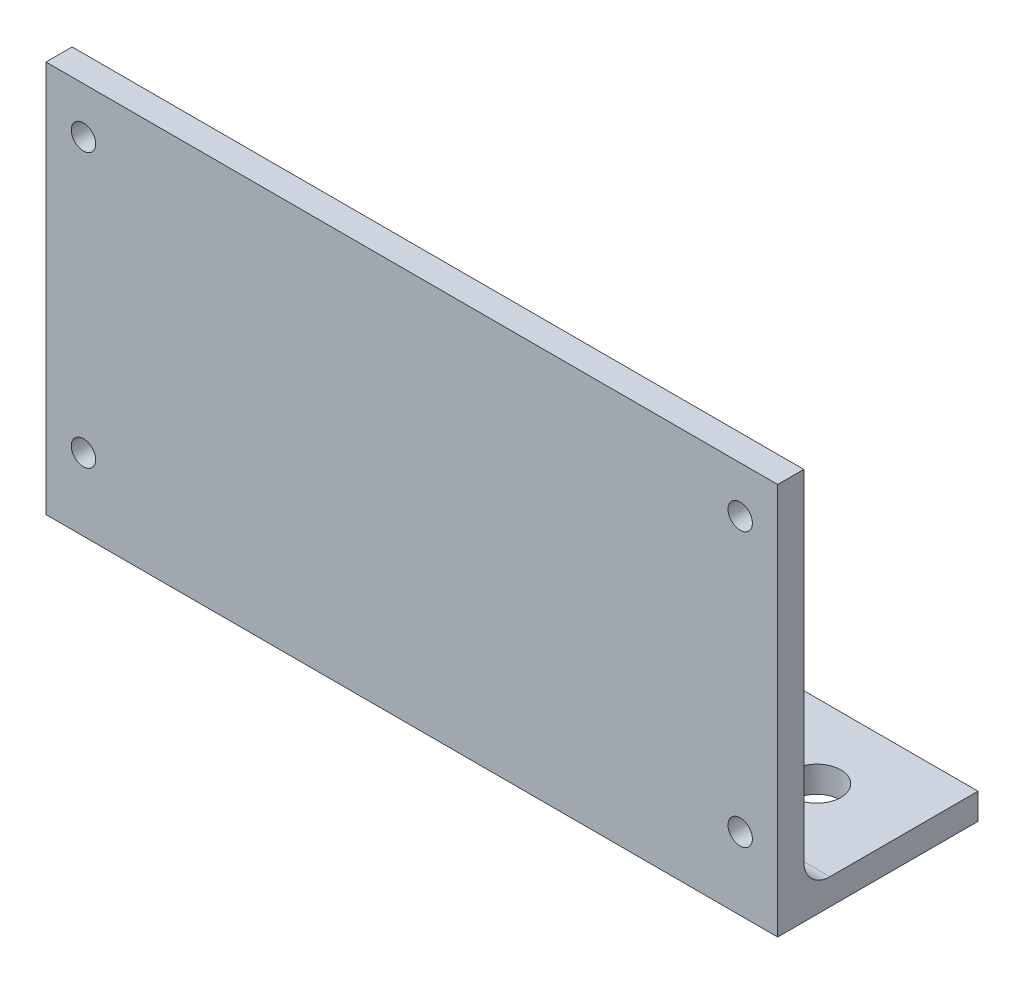
from build123d import *

# Parameters (mm, degrees)
SKETCH1_W                = 84
SKETCH1_H                = 42
SKETCH1_R                = 1.4
BOSS_EXTRUDE1_DEPTH      = 3
BOSS_EXTRUDE2_DEPTH      = 20
BOSS_EXTRUDE2_DEPTH_BACK = 3
SKETCH2_W                = 84
SKETCH2_H                = 3
FILLET1_R                = 3
SKETCH5_R                = 2.75
CUT_EXTRUDE1_DEPTH       = 3


with BuildPart() as part:
    # Sketch1 → Boss-Extrude1 (new body)
    with BuildSketch(Plane.XY):
        Rectangle(SKETCH1_W, SKETCH1_H)
        with Locations((-37.7, 15.7)):
            Circle(SKETCH1_R, mode=Mode.SUBTRACT)
        with Locations((37.7, 15.7)):
            Circle(SKETCH1_R, mode=Mode.SUBTRACT)
        with Locations((37.7, -15.7)):
            Circle(SKETCH1_R, mode=Mode.SUBTRACT)
        with Locations((-37.7, -15.7)):
            Circle(SKETCH1_R, mode=Mode.SUBTRACT)
    extrude(amount=BOSS_EXTRUDE1_DEPTH)

    # Sketch2 → Boss-Extrude2 (add, two sides: drawn at the far end of the back side and taken through both)
    with BuildSketch(Plane(origin=(0, 0, 0), x_dir=(-1, 0, 0), z_dir=(0, 0, -1)).offset(-BOSS_EXTRUDE2_DEPTH_BACK)):
        with Locations((0, -22.5)):
            Rectangle(SKETCH2_W, SKETCH2_H)
    extrude(amount=BOSS_EXTRUDE2_DEPTH + BOSS_EXTRUDE2_DEPTH_BACK)

    # Fillet1
    fillet1_edges = [part.edges().sort_by_distance(p)[0] for p in [
        (0, -21, 0),
    ]]
    fillet(fillet1_edges, radius=FILLET1_R)

    # Sketch5 → Cut-Extrude1 (cut)
    with BuildSketch(Plane(origin=(0, -21, 0), x_dir=(1, 0, 0), z_dir=(0, 1, 0))):
        with Locations(Location((-32, 11.5, 0), (0, 0, 270))):
            Circle(SKETCH5_R)
        with Locations(Location((32, 11.5, 0), (0, 0, 270))):
            Circle(SKETCH5_R)
    extrude(amount=-CUT_EXTRUDE1_DEPTH, mode=Mode.SUBTRACT)


solid = part.part
